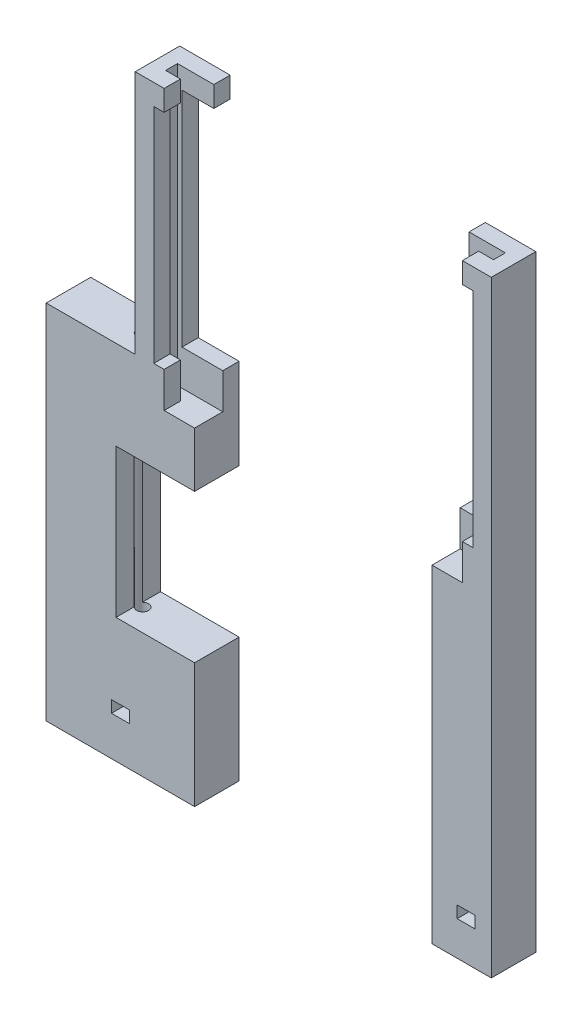
from build123d import *

# Parameters (mm, degrees)
CROQUIS1_W                  = 220
CROQUIS1_H                  = 204.5
SALIENTE_EXTRUIR1_DEPTH     = 7
CROQUIS2_R                  = 11
CROQUIS2_R_2                = 10
CROQUIS2_R_3                = 14
CORTAR_EXTRUIR1_DEPTH       = 151.346474851
CROQUIS3_W                  = 6
CROQUIS3_H                  = 12
CORTAR_EXTRUIR2_DEPTH       = 10
CROQUIS4_W                  = 220
CROQUIS4_H                  = 7
SALIENTE_EXTRUIR2_DEPTH     = 150.6
CROQUIS5_W                  = 220
CROQUIS5_H                  = 7
SALIENTE_EXTRUIR3_DEPTH     = 197.5
CROQUIS6_W                  = 6
CROQUIS6_H                  = 12
CORTAR_EXTRUIR3_DEPTH       = 150.6
CROQUIS7_R                  = 2.5
CORTAR_EXTRUIR4_DEPTH       = 10
CROQUIS8_W                  = 20
CROQUIS8_H                  = 15
SALIENTE_EXTRUIR4_DEPTH     = 197.5
CROQUIS9_W                  = 110.5
CROQUIS9_H                  = 4
CORTAR_EXTRUIR5_DEPTH       = 94
CROQUIS11_R                 = 2.5
CORTAR_EXTRUIR6_DEPTH       = 10
CORTAR_EXTRUIR7_REACH       = 188.514
CROQUIS10_W                 = 13.75
CROQUIS10_H                 = 75
CORTAR_EXTRUIR8_REACH       = 282.639
CROQUIS12_W                 = 10.25034787
CROQUIS12_H                 = 5.500172095
CROQUIS12_W_2               = 10.24965213
CROQUIS13_W                 = 3
CROQUIS13_H                 = 5.499827905
CORTAR_EXTRUIR9_DEPTH       = 7
CORTAR_EXTRUIR10_DEPTH      = 15
SALIENTE_EXTRUIR5_DEPTH     = 15
CORTAR_EXTRUIR13_DEPTH      = 276.579407794
CORTAR_EXTRUIR13_DEPTH_BACK = 276.579407794
CROQUIS19_R                 = 2
CROQUIS19_R_2               = 1.999827905
CROQUIS20_W                 = 220
CROQUIS20_H                 = 95.6
CROQUIS20_H_2               = 47
CORTAR_EXTRUIR14_DEPTH      = 281.638575395
CROQUIS21_W                 = 20
CROQUIS21_H                 = 15
CROQUIS21_W_2               = 80
CROQUIS21_W_3               = 50
CORTAR_EXTRUIR15_DEPTH      = 252.671631298
CROQUIS22_W                 = 6
CROQUIS22_H                 = 4
CORTAR_EXTRUIR16_DEPTH      = 138.04036814


with BuildPart() as part:
    # Croquis1 → Saliente-Extruir1 (new body)
    with BuildSketch(Plane.XY):
        Rectangle(CROQUIS1_W, CROQUIS1_H)
    extrude(amount=SALIENTE_EXTRUIR1_DEPTH)

    # Croquis2 → Cortar-Extruir1 (cut, through all)
    with BuildSketch(Plane.XY.offset(7)):
        with Locations((-90, 62.25)):
            Circle(CROQUIS2_R)
        with Locations(Location((90, 62.25, 0), (0, 0, 180))):
            Circle(CROQUIS2_R)
        with Locations((0, 62.25)):
            Circle(CROQUIS2_R_2)
        with Locations((90, 3.25)):
            Circle(CROQUIS2_R)
        with Locations(Location((0, 3.25, 0), (0, 0, 180))):
            Circle(CROQUIS2_R_2)
        with Locations(Location((-90, 3.25, 0), (0, 0, 180))):
            Circle(CROQUIS2_R)
        with Locations((-45, -32.25)):
            Circle(CROQUIS2_R_3)
        with Locations((-45, -72.25)):
            Circle(CROQUIS2_R_3)
        with Locations((45, -59.625285127)):
            Circle(CROQUIS2_R)
    extrude(amount=-CORTAR_EXTRUIR1_DEPTH, mode=Mode.SUBTRACT)

    # Croquis3 → Cortar-Extruir2 (cut)
    with BuildSketch(Plane.XY.offset(7)):
        with Locations((-107, 96.25)):
            Rectangle(CROQUIS3_W, CROQUIS3_H)
    extrude(amount=-CORTAR_EXTRUIR2_DEPTH, mode=Mode.SUBTRACT)

    # Croquis4 → Saliente-Extruir2 (add)
    with BuildSketch(Plane.XY.offset(7)):
        with Locations((0, -98.75)):
            Rectangle(CROQUIS4_W, CROQUIS4_H)
    extrude(amount=SALIENTE_EXTRUIR2_DEPTH)

    # Croquis5 → Saliente-Extruir3 (add)
    with BuildSketch(Plane(origin=(0, -95.25, 0), x_dir=(1, 0, 0), z_dir=(0, 1, 0))):
        with Locations((0, -154.1)):
            Rectangle(CROQUIS5_W, CROQUIS5_H)
    extrude(amount=SALIENTE_EXTRUIR3_DEPTH)

    # Croquis6 → Cortar-Extruir3 (cut)
    with BuildSketch(Plane(origin=(0, 0, 150.6), x_dir=(-1, 0, 0), z_dir=(0, 0, -1))):
        with Locations((107, 96.25)):
            Rectangle(CROQUIS6_W, CROQUIS6_H)
    extrude(amount=-CORTAR_EXTRUIR3_DEPTH, mode=Mode.SUBTRACT)

    # Croquis7 → Cortar-Extruir4 (cut)
    with BuildSketch(Plane.XY.offset(157.6)):
        with Locations((-90, 72.25)):
            Circle(CROQUIS7_R)
        with Locations((-17, 72.25)):
            Circle(CROQUIS7_R)
        with Locations((-53.5, 72.25)):
            Circle(CROQUIS7_R)
        with Locations((96, 72.25)):
            Circle(CROQUIS7_R)
        with Locations((59.5, 72.25)):
            Circle(CROQUIS7_R)
        with Locations((23, 72.25)):
            Circle(CROQUIS7_R)
        with Locations((96, 42.25)):
            Circle(CROQUIS7_R)
        with Locations((59.5, 42.25)):
            Circle(CROQUIS7_R)
        with Locations((23, 42.25)):
            Circle(CROQUIS7_R)
        with Locations((-17, 42.25)):
            Circle(CROQUIS7_R)
        with Locations((-53.5, 42.25)):
            Circle(CROQUIS7_R)
        with Locations((-90, 42.25)):
            Circle(CROQUIS7_R)
        with Locations((96, 12.25)):
            Circle(CROQUIS7_R)
        with Locations((59.5, 12.25)):
            Circle(CROQUIS7_R)
        with Locations((23, 12.25)):
            Circle(CROQUIS7_R)
        with Locations((-17, 12.25)):
            Circle(CROQUIS7_R)
        with Locations((-53.5, 12.25)):
            Circle(CROQUIS7_R)
        with Locations((-90, 12.25)):
            Circle(CROQUIS7_R)
    extrude(amount=-CORTAR_EXTRUIR4_DEPTH, mode=Mode.SUBTRACT)

    # Croquis8 → Saliente-Extruir4 (add)
    with BuildSketch(Plane(origin=(0, -95.25, 0), x_dir=(1, 0, 0), z_dir=(0, 1, 0))):
        with Locations((-50, -103.1)):
            Rectangle(CROQUIS8_W, CROQUIS8_H)
        with Locations((50, -103.1)):
            Rectangle(CROQUIS8_W, CROQUIS8_H)
    extrude(amount=SALIENTE_EXTRUIR4_DEPTH)

    # Croquis9 → Cortar-Extruir5 (cut)
    with BuildSketch(Plane(origin=(0, 102.25, 0), x_dir=(1, 0, 0), z_dir=(0, 1, 0))):
        with Locations((-0.00034787, -103.099827905)):
            Rectangle(CROQUIS9_W, CROQUIS9_H)
    extrude(amount=-CORTAR_EXTRUIR5_DEPTH, mode=Mode.SUBTRACT)

    # Croquis11 → Cortar-Extruir6 (cut)
    with BuildSketch(Plane.XY.offset(157.6)):
        with Locations((-10, -77.25)):
            Circle(CROQUIS11_R)
        with Locations((10, -77.25)):
            Circle(CROQUIS11_R)
        with Locations((-63.5, -37.25)):
            Circle(CROQUIS11_R)
        with Locations((-43.5, -37.25)):
            Circle(CROQUIS11_R)
        with Locations((43.5, -37.25)):
            Circle(CROQUIS11_R)
        with Locations((63.5, -37.25)):
            Circle(CROQUIS11_R)
    extrude(amount=-CORTAR_EXTRUIR6_DEPTH, mode=Mode.SUBTRACT)

    # Cortar-Extruir7: up to this face of the body (flat: up to its plane)
    cortar_extruir7_end = Plane(part.part.faces().sort_by_distance((-50, 3.5, 95.6))[0])
    # Croquis10 → Cortar-Extruir7 (cut, up to the picked face)
    with BuildSketch(Plane.XY.offset(110.6), mode=Mode.PRIVATE) as cortar_extruir7_sk1:
        with Locations((-46.875, 57.75)):
            Rectangle(CROQUIS10_W, CROQUIS10_H)
    cortar_extruir7_tool1 = split(extrude(cortar_extruir7_sk1.sketch, amount=-CORTAR_EXTRUIR7_REACH, mode=Mode.PRIVATE), bisect_by=cortar_extruir7_end, keep=Keep.BOTH, mode=Mode.PRIVATE)
    # Croquis10 → Cortar-Extruir7 (cut, up to the picked face)
    with BuildSketch(Plane.XY.offset(110.6), mode=Mode.PRIVATE) as cortar_extruir7_sk2:
        with Locations((46.875, 57.75)):
            Rectangle(CROQUIS10_W, CROQUIS10_H)
    cortar_extruir7_tool2 = split(extrude(cortar_extruir7_sk2.sketch, amount=-CORTAR_EXTRUIR7_REACH, mode=Mode.PRIVATE), bisect_by=cortar_extruir7_end, keep=Keep.BOTH, mode=Mode.PRIVATE)
    add(cortar_extruir7_tool1.solids().sort_by(Axis((-46.875, 57.75, 110.6), (0, 0, -1)))[0], mode=Mode.SUBTRACT)
    add(cortar_extruir7_tool2.solids().sort_by(Axis((46.875, 57.75, 110.6), (0, 0, -1)))[0], mode=Mode.SUBTRACT)

    # Cortar-Extruir8: up to this face of the body (flat: up to its plane)
    cortar_extruir8_end = Plane(part.part.faces().sort_by_distance((-47.625173935, 8.25, 103.099827905))[0])
    # Croquis12 → Cortar-Extruir8 (cut, up to the picked face)
    with BuildSketch(Plane(origin=(0, 102.25, 0), x_dir=(1, 0, 0), z_dir=(0, 1, 0)), mode=Mode.PRIVATE) as cortar_extruir8_sk1:
        with Locations((-45.125173935, -107.849913953)):
            Rectangle(CROQUIS12_W, CROQUIS12_H)
    cortar_extruir8_tool1 = split(extrude(cortar_extruir8_sk1.sketch, amount=-CORTAR_EXTRUIR8_REACH, mode=Mode.PRIVATE), bisect_by=cortar_extruir8_end, keep=Keep.BOTH, mode=Mode.PRIVATE)
    # Croquis12 → Cortar-Extruir8 (cut, up to the picked face)
    with BuildSketch(Plane(origin=(0, 102.25, 0), x_dir=(1, 0, 0), z_dir=(0, 1, 0)), mode=Mode.PRIVATE) as cortar_extruir8_sk2:
        with Locations((45.124826065, -107.849913953)):
            Rectangle(CROQUIS12_W_2, CROQUIS12_H)
    cortar_extruir8_tool2 = split(extrude(cortar_extruir8_sk2.sketch, amount=-CORTAR_EXTRUIR8_REACH, mode=Mode.PRIVATE), bisect_by=cortar_extruir8_end, keep=Keep.BOTH, mode=Mode.PRIVATE)
    add(cortar_extruir8_tool1.solids().sort_by(Axis((-45.125174, 102.25, 107.849914), (0, -1, 0)))[0], mode=Mode.SUBTRACT)
    add(cortar_extruir8_tool2.solids().sort_by(Axis((45.124826, 102.25, 107.849914), (0, -1, 0)))[0], mode=Mode.SUBTRACT)

    # Croquis13 → Cortar-Extruir9 (cut)
    with BuildSketch(Plane(origin=(0, 102.25, 0), x_dir=(1, 0, 0), z_dir=(0, 1, 0))):
        with Locations((-41.5, -98.349913953)):
            Rectangle(CROQUIS13_W, CROQUIS13_H)
        with Locations((41.5, -98.349913953)):
            Rectangle(CROQUIS13_W, CROQUIS13_H)
    extrude(amount=-CORTAR_EXTRUIR9_DEPTH, mode=Mode.SUBTRACT)

    # Croquis14 → Cortar-Extruir10 (cut)
    with BuildSketch(Plane.XY.offset(110.6)):
        Polygon((-40, -10.25), (-51.479605867, -10.25), (-60, -10.25), (-60, -60.25), (-40, -60.25), align=None)
    extrude(amount=-CORTAR_EXTRUIR10_DEPTH, mode=Mode.SUBTRACT)


with BuildPart() as cortar_extruir10_piece_1:
    # of the separate pieces the step leaves, piece 1, a body of its own (cortar_extruir10_pieces)
    add(part.part.solids().sort_by_distance((-104, 102.25, 0))[0])



with BuildPart() as cortar_extruir10_piece_2:
    # of the separate pieces the step leaves, piece 2, a body of its own (cortar_extruir10_pieces)
    add(part.part.solids().sort_by_distance((-40, -10.25, 95.6))[0])


with BuildPart() as cortar_extruir10_piece_1_1:
    add(cortar_extruir10_piece_1.part)

    add(cortar_extruir10_piece_2.part)  # Saliente-Extruir5 merges Cortar-Extruir10 piece 2
    # Croquis15 → Saliente-Extruir5 (add)
    with BuildSketch(Plane.XY.offset(110.6)):
        Polygon((-60, 19.75), (-90, 19.75), (-90, -95.25), (-60, -95.25), (-60, -60.25), (-66.476045764, -60.25), (-66.476045764, -10.25), (-60, -10.25), align=None)
    extrude(amount=-SALIENTE_EXTRUIR5_DEPTH)

    # Croquis19 → Cortar-Extruir13 (cut, two sides: drawn at the far end of the back side and taken through both)
    with BuildSketch(Plane(origin=(0, -95.25, 0), x_dir=(1, 0, 0), z_dir=(0, 1, 0)).offset(-CORTAR_EXTRUIR13_DEPTH_BACK)):
        with Locations(Location((-65, -103.1, 0), (0, 0, 180))):
            Circle(CROQUIS19_R)
        with Locations(Location((51.5, -103.1, 0), (0, 0, 270))):
            Circle(CROQUIS19_R_2)
    extrude(amount=CORTAR_EXTRUIR13_DEPTH + CORTAR_EXTRUIR13_DEPTH_BACK, mode=Mode.SUBTRACT)

    # Croquis20 → Cortar-Extruir14 (cut, through all)
    with BuildSketch(Plane(origin=(0, 102.25, 0), x_dir=(1, 0, 0), z_dir=(0, 1, 0))):
        with Locations((0, -47.8)):
            Rectangle(CROQUIS20_W, CROQUIS20_H)
        with Locations((0, -134.1)):
            Rectangle(CROQUIS20_W, CROQUIS20_H_2)
    extrude(amount=-CORTAR_EXTRUIR14_DEPTH, mode=Mode.SUBTRACT)

    # Croquis21 → Cortar-Extruir15 (cut, through all)
    with BuildSketch(Plane(origin=(0, -95.25, 0), x_dir=(1, 0, 0), z_dir=(0, 1, 0))):
        with Locations((-100, -103.1)):
            Rectangle(CROQUIS21_W, CROQUIS21_H)
        with Locations((0, -103.1)):
            Rectangle(CROQUIS21_W_2, CROQUIS21_H)
        with Locations((85, -103.1)):
            Rectangle(CROQUIS21_W_3, CROQUIS21_H)
    extrude(amount=-CORTAR_EXTRUIR15_DEPTH, mode=Mode.SUBTRACT)


with BuildPart() as cortar_extruir15_piece_1:
    # of the separate pieces the step leaves, piece 1, a body of its own (cortar_extruir15_pieces)
    add(cortar_extruir10_piece_1_1.part.solids().sort_by_distance((-40, -10.25, 95.6))[0])


with BuildPart() as cortar_extruir15_piece_2:
    # of the separate pieces the step leaves, piece 2, a body of its own (cortar_extruir15_pieces)
    add(cortar_extruir10_piece_1_1.part.solids().sort_by_distance((40, -102.25, 95.6))[0])


with BuildPart() as cortar_extruir16_tool:
    # Croquis22 → Cortar-Extruir16 (new, through all)
    with BuildSketch(Plane.XY.offset(110.6)):
        with Locations((-65, -86.99392464)):
            Rectangle(CROQUIS22_W, CROQUIS22_H)
        with Locations((51.500172095, -88.675276493)):
            Rectangle(CROQUIS22_W, CROQUIS22_H)
    extrude(amount=-CORTAR_EXTRUIR16_DEPTH)


with BuildPart() as cortar_extruir15_piece_1_1:
    add(cortar_extruir15_piece_1.part)

    # Cortar-Extruir16: cut by cortar_extruir16_tool
    add(cortar_extruir16_tool.part, mode=Mode.SUBTRACT)


with BuildPart() as cortar_extruir15_piece_2_1:
    add(cortar_extruir15_piece_2.part)

    # Cortar-Extruir16: cut by cortar_extruir16_tool
    add(cortar_extruir16_tool.part, mode=Mode.SUBTRACT)


solid = Compound([cortar_extruir15_piece_1_1.part, cortar_extruir15_piece_2_1.part])
